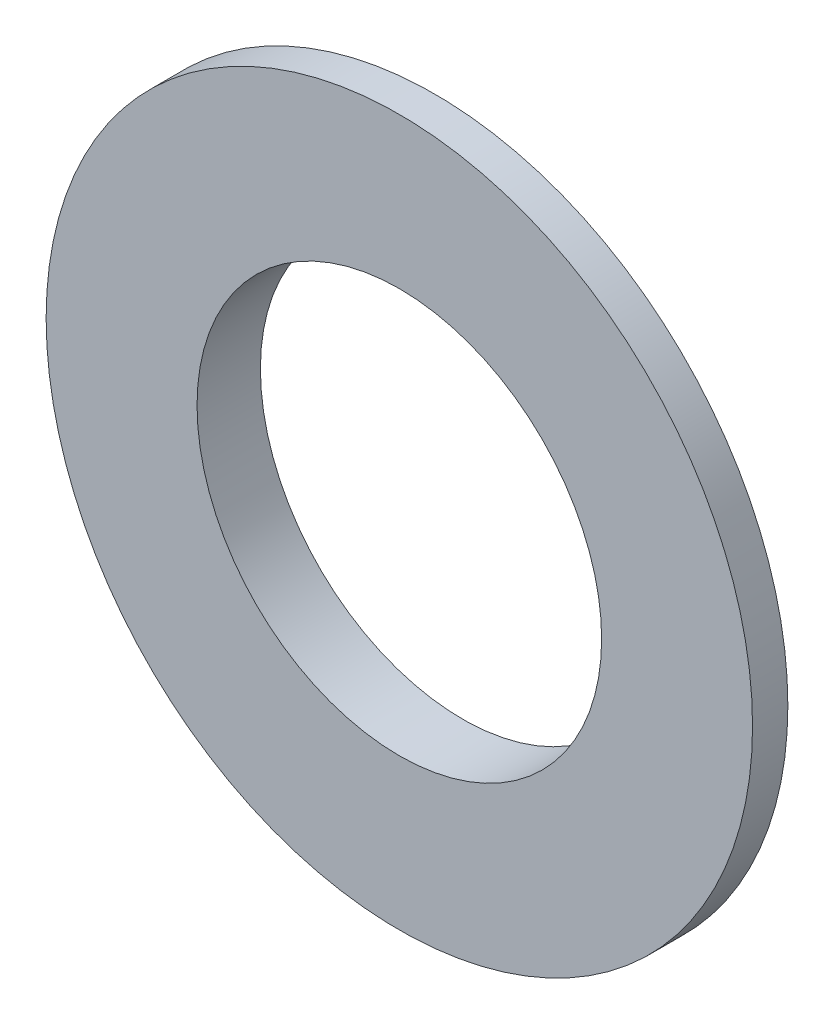
from build123d import *
from build123d.topology import SkipClean

# Parameters (mm, degrees)
SKETCH1_R           = 20
SKETCH1_R_2         = 14.619
SKETCH1_R_3         = 11.455
BOSS_EXTRUDE1_DEPTH = 2
BOSS_EXTRUDE2_START = 1.5875
SKETCH2_R           = 14.619
SKETCH2_R_2         = 11.455
BOSS_EXTRUDE2_DEPTH = 1.5875


with BuildPart() as part:
    # Sketch1 → Boss-Extrude1 (new body)
    # profile 1 of 2: a face of its own
    with BuildSketch(Plane.XY):
        Circle(SKETCH1_R)
        Circle(SKETCH1_R_2, mode=Mode.SUBTRACT)
    # profile 2 of 2: a face of its own
    with BuildSketch(Plane.XY):
        Circle(SKETCH1_R_2)
        Circle(SKETCH1_R_3, mode=Mode.SUBTRACT)
    extrude(amount=BOSS_EXTRUDE1_DEPTH)

    # Sketch2 → Boss-Extrude2 (add)
    with SkipClean():  # the faces are left unmerged after this step: merging them gives an invalid solid
        with BuildSketch(Plane(origin=(0, 0, 0), x_dir=(-1, 0, 0), z_dir=(0, 0, -1)).offset(BOSS_EXTRUDE2_START)):
            with Locations(Location((0, 0, 0), (0, 0, 180))):
                Circle(SKETCH2_R)
            Circle(SKETCH2_R_2, mode=Mode.SUBTRACT)
        extrude(amount=-BOSS_EXTRUDE2_DEPTH)


solid = part.part
